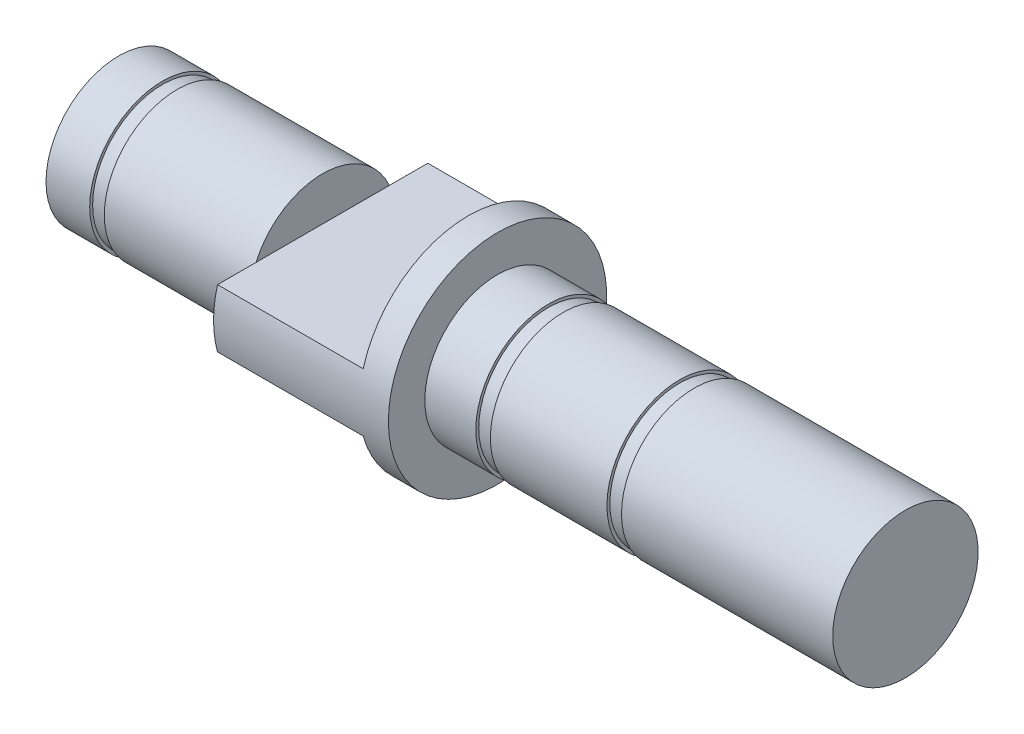
from build123d import *

# Parameters (mm, degrees)
CUT_EXTRUDE8_DEPTH = 10


with BuildPart() as part:
    # Sketch3 → Revolve1 (revolve)
    with BuildSketch(Plane(origin=(0, 0, 0), x_dir=(1, 0, 0), z_dir=(0, 1, 0)), mode=Mode.PRIVATE) as revolve1_sk:
        Polygon((0, 0), (54, 0), (54, 4.99), (39.5, 4.99), (39.5, 4.79), (38.5, 4.79), (38.5, 4.99), (30.5, 4.99), (30.5, 4.79), (29.5, 4.79), (29.5, 4.99), (26, 4.99), (26, 7.49), (14, 7.49), (14, 4.99), (4, 4.99), (4, 4.79), (3, 4.79), (3, 4.99), (0, 4.99), align=None)
    revolve(revolve1_sk.sketch.rotate(Axis((0, 0, 0), (1, 0, 0)), 180), axis=Axis((0, 0, 0), (1, 0, 0)))

    # Sketch10 → Cut-Extrude8 (cut)
    with BuildSketch(Plane.ZY.offset(-14)):
        with BuildLine():
            Line((7.228416147, 2), (-7.228416147, 2))
            ThreePointArc((-7.228416147, 2), (0, 7.5), (7.228416147, 2))
        make_face()
        with BuildLine():
            Line((7.228416147, -2), (-7.228416147, -2))
            ThreePointArc((-7.228416147, -2), (0, -7.5), (7.228416147, -2))
        make_face()
    extrude(amount=-CUT_EXTRUDE8_DEPTH, mode=Mode.SUBTRACT)


solid = part.part
